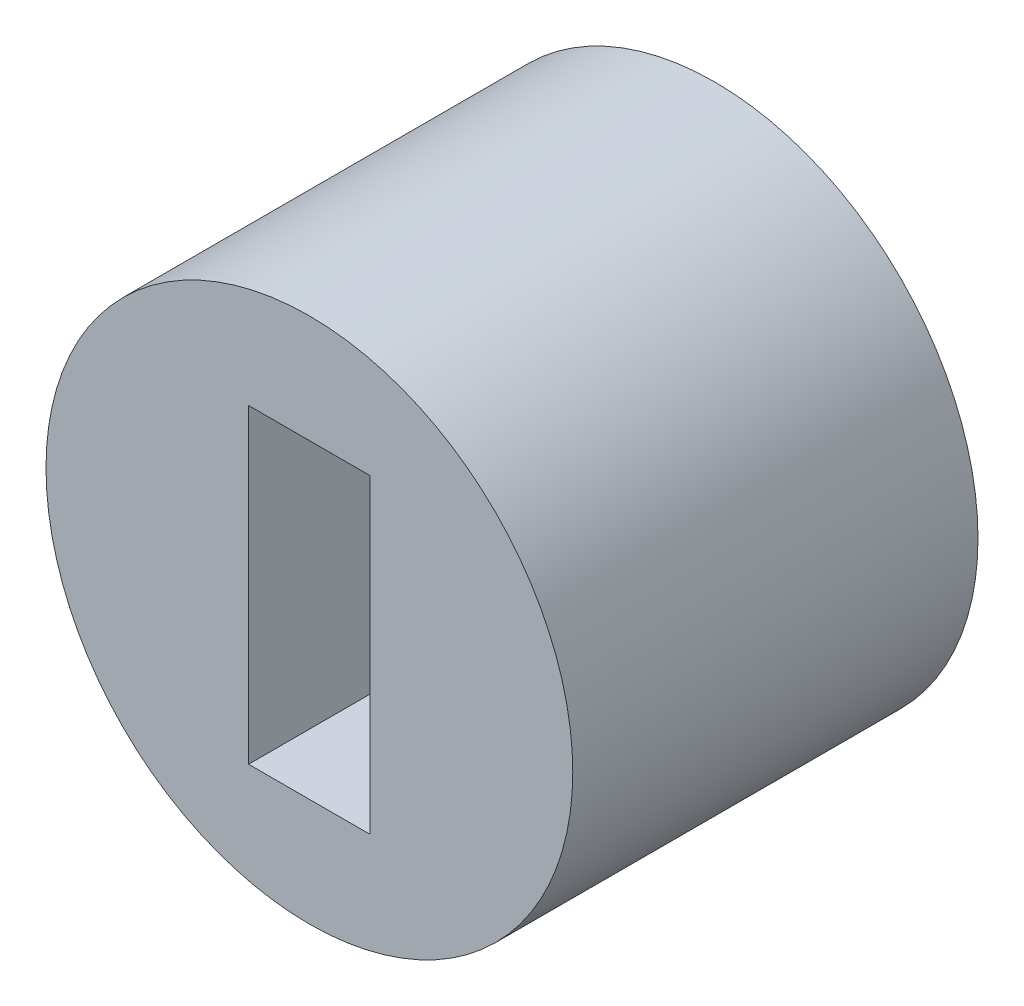
from build123d import *

# Parameters (mm, degrees)
SKETCH1_R      = 1.95
SKETCH1_W      = 0.9
SKETCH1_H      = 2.3
EXT_BODY_DEPTH = 3


with BuildPart() as part:
    # Sketch1 → ext-body (new body)
    with BuildSketch(Plane.XY):
        Circle(SKETCH1_R)
        Rectangle(SKETCH1_W, SKETCH1_H, mode=Mode.SUBTRACT)
    extrude(amount=-EXT_BODY_DEPTH)


solid = part.part
